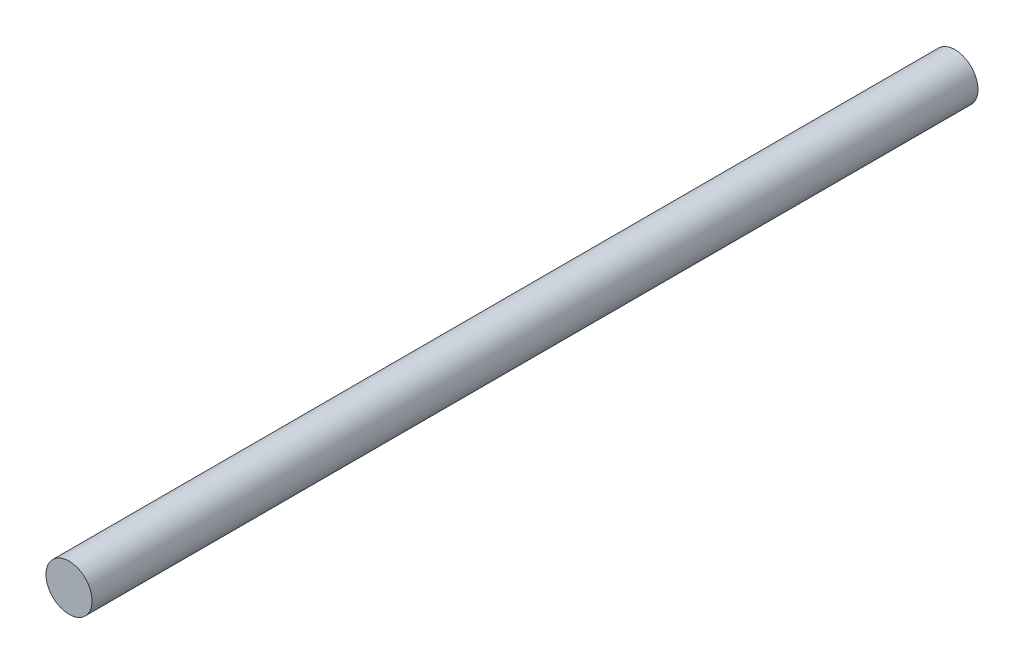
from build123d import *

# Parameters (mm, degrees)
SKETCH2_R           = 2.5
BOSS_EXTRUDE1_DEPTH = 48


with BuildPart() as part:
    # Sketch2 → Boss-Extrude1 (new, symmetric)
    with BuildSketch(Plane.XY):
        Circle(SKETCH2_R)
    extrude(amount=BOSS_EXTRUDE1_DEPTH, both=True)


solid = part.part
